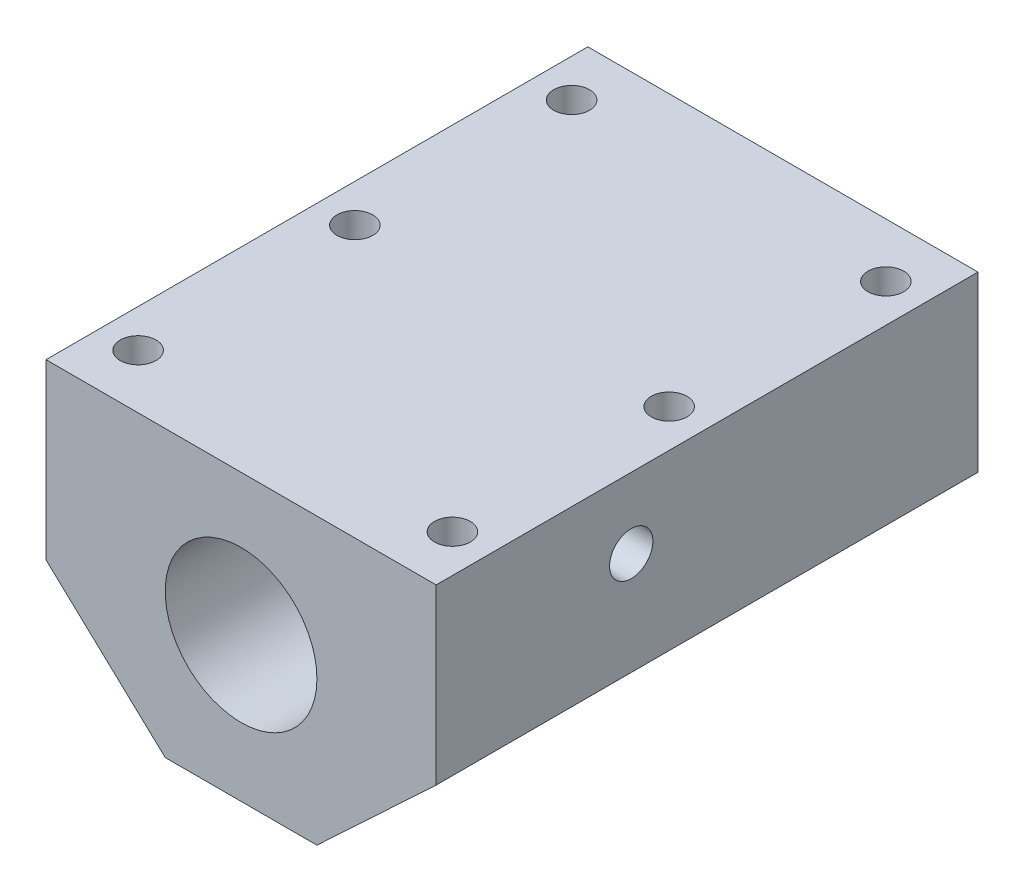
from build123d import *

# Parameters (mm, degrees)
EXTRUDE_1_DEPTH             = 50
SKETCH_2_OUTSIDE_W          = 51.398
SKETCH_2_OUTSIDE_H          = 41.698
SKETCH_2_OUTSIDE_R          = 7
CUT_EXTRUDE_3_DEPTH         = 10
SKETCH_5_R                  = 11
CUT_EXTRUDE_5_DEPTH         = 27
HOLE_WIZARD_M4_1_AT_2_COUNT = 2
HOLE_WIZARD_M4_1_AT_2_PITCH = 20
HOLE_WIZARD_M4_1_AT_3_COUNT = 2
HOLE_WIZARD_M4_1_AT_3_PITCH = 40
CUT_EXTRUDE_1_DEPTH         = 34
HOLE_WIZARD_3_0_3_1_REACH   = 65.031
HOLE_WIZARD_3_0_3_1_BORE_R  = 1.5
SKETCH_65_R                 = 2
CUT_EXTRUDE_2_DEPTH         = 5


with BuildPart() as part:
    # 草图1 → 拉伸1 (new body)
    with BuildSketch(Plane.XY):
        Polygon((-18, 13), (-18, -3), (-7, -13.3), (7, -13.3), (18, -3), (18, 13), align=None)
    extrude(amount=EXTRUDE_1_DEPTH)

    # 草图2 outside → 拉伸3 (cut)
    # profile 1 of 2: a face of its own
    with BuildSketch(Plane.XY.offset(50)):
        with Locations((0, -0.15)):
            Rectangle(SKETCH_2_OUTSIDE_W, SKETCH_2_OUTSIDE_H)
        Polygon((18, -3), (18, 13), (-18, 13), (-18, -3), (-7, -13.3), (7, -13.3), align=None, mode=Mode.SUBTRACT)
    # profile 2 of 2: a face of its own
    with BuildSketch(Plane.XY.offset(50)):
        Circle(SKETCH_2_OUTSIDE_R)
    extrude(amount=-CUT_EXTRUDE_3_DEPTH, mode=Mode.SUBTRACT)

    # 草图5 → 拉伸5 (cut)
    with BuildSketch(Plane.XY.offset(40)):
        Circle(SKETCH_5_R)
    extrude(amount=-CUT_EXTRUDE_5_DEPTH, mode=Mode.SUBTRACT)

    # 草图57 → M24 螺纹孔1 (revolve, cut)
    with BuildSketch(Plane(origin=(0, 0, 13), x_dir=(0, -1, 0), z_dir=(1, 0, 0))):
        Polygon((0, 0), (0, 19.909897119), (11.5, 13), (11.5, 0), align=None)
    revolve(axis=Axis((0, 0, 19.35), (0, 0, -1)), mode=Mode.SUBTRACT)

    # 草图58 → M4 螺纹孔1 (revolve, cut)
    with BuildSketch(Plane(origin=(-14.5, 13, 5), x_dir=(0, 0, 1), z_dir=(1, 0, 0))):
        Polygon((0, 0), (0, 12.491420021), (1.65, 11.5), (1.65, 0), align=None)
    hole_wizard_m4_1 = revolve(axis=Axis((-14.5, 19.35, 5), (0, -1, 0)), mode=Mode.SUBTRACT)

    # M4 螺纹孔1 at 2: M4 螺纹孔1 ×2
    with Locations(*[(0, 0, i * HOLE_WIZARD_M4_1_AT_2_PITCH) for i in range(1, HOLE_WIZARD_M4_1_AT_2_COUNT)]):
        add(hole_wizard_m4_1, mode=Mode.SUBTRACT)

    # M4 螺纹孔1 at 3: M4 螺纹孔1 ×2
    with Locations(*[(0, 0, i * HOLE_WIZARD_M4_1_AT_3_PITCH) for i in range(1, HOLE_WIZARD_M4_1_AT_3_COUNT)]):
        add(hole_wizard_m4_1, mode=Mode.SUBTRACT)

    # 镜向1: M4 螺纹孔1 across plane
    add(hole_wizard_m4_1.mirror(Plane(origin=(0, 0, 0), x_dir=(0, 0, 1), z_dir=(1, 0, 0))), mode=Mode.SUBTRACT)

    # 镜向1 copy 1 sketch → 镜向1 copy 1 (revolve, cut)
    with BuildSketch(Plane(origin=(14.5, 13, 25), x_dir=(0, 0, 1), z_dir=(-1, 0, 0))):
        Polygon((0, 0), (0, -12.491420021), (1.65, -11.5), (1.65, 0), align=None)
    revolve(axis=Axis((14.5, 19.35, 25), (0, 1, 0)), mode=Mode.SUBTRACT)

    # 镜向1 copy 2 sketch → 镜向1 copy 2 (revolve, cut)
    with BuildSketch(Plane(origin=(14.5, 13, 45), x_dir=(0, 0, 1), z_dir=(-1, 0, 0))):
        Polygon((0, 0), (0, -12.491420021), (1.65, -11.5), (1.65, 0), align=None)
    revolve(axis=Axis((14.5, 19.35, 45), (0, 1, 0)), mode=Mode.SUBTRACT)

    # 草图61 → 切除-拉伸1 (cut)
    with BuildSketch(Plane(origin=(0, 0, 0), x_dir=(-1, 0, 0), z_dir=(0, 0, -1))):
        with BuildLine():
            Line((-9.337993294, 8.980082474), (1.147152873, 1.638304089))
            ThreePointArc((1.147152873, 1.638304089), (1.638304089, -1.147152873), (-1.147152873, -1.638304089))
            Line((-1.147152873, -1.638304089), (-11.63229904, 5.703474297))
            ThreePointArc((-11.63229904, 5.703474297), (-12.123450255, 8.488931258), (-9.337993294, 8.980082474))
        make_face()
    extrude(amount=-CUT_EXTRUDE_1_DEPTH, mode=Mode.SUBTRACT)

    # Ø3.0 (3) 直径孔1 bore → Ø3.0 (3) 直径孔1 (cut, up to next)
    with BuildSketch(Plane(origin=(18, 0, 0), x_dir=(0, 0, -1), z_dir=(1, 0, 0)), mode=Mode.PRIVATE) as hole_wizard_3_0_3_1_sk1:
        with Locations((-32, 6.5)):
            Circle(HOLE_WIZARD_3_0_3_1_BORE_R)
    hole_wizard_3_0_3_1_tool1 = extrude(hole_wizard_3_0_3_1_sk1.sketch, amount=-HOLE_WIZARD_3_0_3_1_REACH, mode=Mode.PRIVATE) & part.part
    add(hole_wizard_3_0_3_1_tool1.solids().sort_by_distance((18, 6.5, 32))[0], mode=Mode.SUBTRACT)

    # 草图65 → 切除-拉伸2 (cut)
    with BuildSketch(Plane(origin=(18, 0, 0), x_dir=(0, 0, -1), z_dir=(1, 0, 0))):
        with Locations((-32, 6.5)):
            Circle(SKETCH_65_R)
    extrude(amount=-CUT_EXTRUDE_2_DEPTH, mode=Mode.SUBTRACT)


solid = part.part
